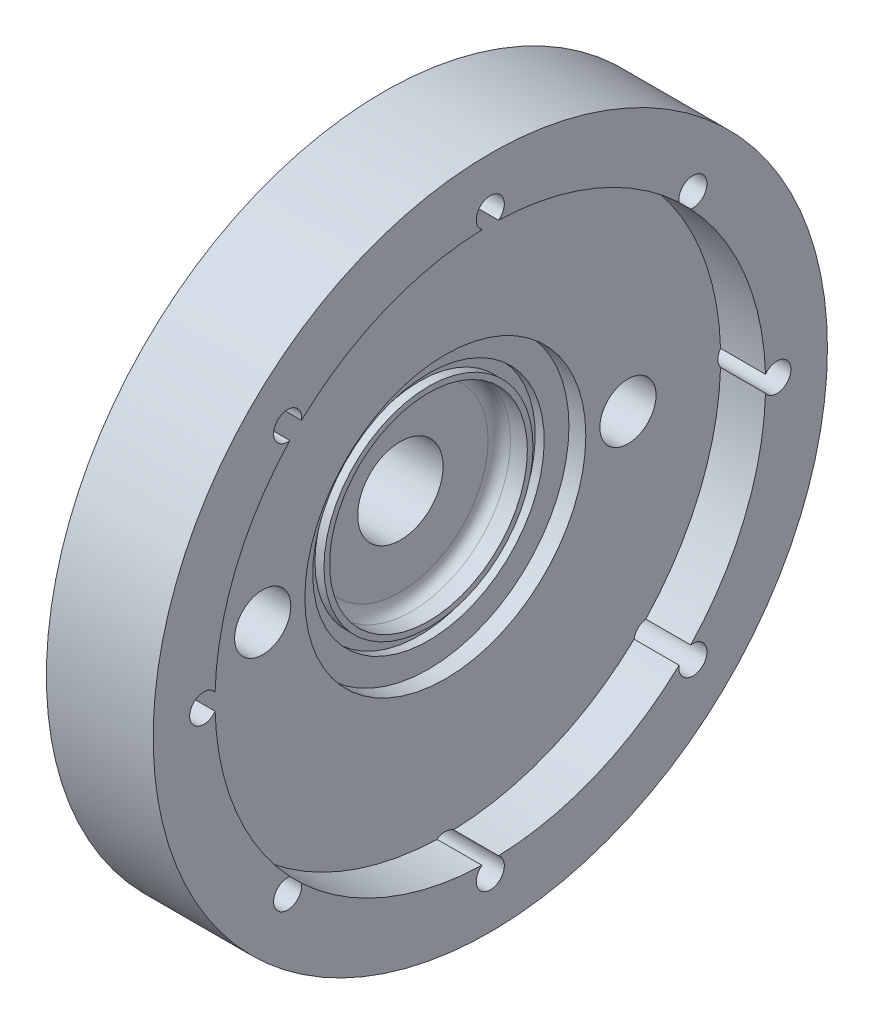
from build123d import *

# Parameters (mm, degrees)
SKETCH4_W               = 2.032
SKETCH4_H               = 2.54
SKETCH5_R               = 76.2
SKETCH5_R_2             = 31.75
BOSS_EXTRUDE1_DEPTH     = 3.81
SKETCH6_R               = 76.2
SKETCH6_R_2             = 62.23
BOSS_EXTRUDE2_DEPTH     = 10.16
CUT_EXTRUDE1_DEPTH      = 113.342968182
CUT_EXTRUDE1_DEPTH_BACK = 113.342968182
SKETCH2_R               = 6.35
SKETCH3_R               = 3.175
CUT_EXTRUDE2_DEPTH      = 113.342968182
CIRPATTERN1_COUNT       = 8


with BuildPart() as part:
    # Sketch1 → Revolve1 (revolve)
    with BuildSketch(Plane.XY, mode=Mode.PRIVATE) as revolve1_sk:
        with BuildLine():
            Line((0, 76.2), (-10.16, 76.2))
            Line((-10.16, 76.2), (-10.16, 21.082))
            ThreePointArc((-10.16, 21.082), (-11.647897552, 17.489897552), (-15.24, 16.002))
            Line((-15.24, 16.002), (-31.75, 16.002))
            Line((-31.75, 16.002), (-31.75, 9.652))
            Line((-31.75, 9.652), (-6.35, 9.652))
            Line((-6.35, 9.652), (-6.35, 19.812))
            ThreePointArc((-6.35, 19.812), (-5.606051224, 21.608051224), (-3.81, 22.352))
            Line((-3.81, 22.352), (0, 22.352))
            Line((0, 22.352), (0, 76.2))
        make_face()
    revolve(revolve1_sk.sketch.rotate(Axis((0, 0, 0), (-1, 0, 0)), 90), axis=Axis((0, 0, 0), (-1, 0, 0)))

    # Sketch4 → Cut-Revolve1 (revolve, cut)
    with BuildSketch(Plane.XY):
        with Locations((-1.016, 24.892)):
            Rectangle(SKETCH4_W, SKETCH4_H)
    revolve(axis=Axis((0, 0, 0), (-1, 0, 0)), mode=Mode.SUBTRACT)

    # Sketch5 → Boss-Extrude1 (add)
    with BuildSketch(Plane(origin=(0, 0, 0), x_dir=(0, 0, -1), z_dir=(1, 0, 0))):
        Circle(SKETCH5_R)
        with Locations(Location((0, 0, 0), (0, 0, 180))):
            Circle(SKETCH5_R_2, mode=Mode.SUBTRACT)
    extrude(amount=BOSS_EXTRUDE1_DEPTH)

    # Sketch6 → Boss-Extrude2 (add)
    with BuildSketch(Plane(origin=(3.81, 0, 0), x_dir=(0, 0, -1), z_dir=(1, 0, 0))):
        Circle(SKETCH6_R)
        Circle(SKETCH6_R_2, mode=Mode.SUBTRACT)
    extrude(amount=BOSS_EXTRUDE2_DEPTH)

    # Sketch2 → Cut-Extrude1 (cut, two sides: drawn at the far end of the back side and taken through both)
    with BuildSketch(Plane(origin=(0, 0, 0), x_dir=(0, 0, -1), z_dir=(1, 0, 0)).offset(-CUT_EXTRUDE1_DEPTH_BACK)):
        with Locations((41.275, 0)):
            Circle(SKETCH2_R)
        with Locations((-41.275, 0)):
            Circle(SKETCH2_R)
    extrude(amount=CUT_EXTRUDE1_DEPTH + CUT_EXTRUDE1_DEPTH_BACK, mode=Mode.SUBTRACT)

    # Sketch3 → Cut-Extrude2 (cut, symmetric)
    with BuildSketch(Plane(origin=(0, 0, 0), x_dir=(0, 0, -1), z_dir=(1, 0, 0))):
        with Locations(Location((64.77, 0, 0), (0, 0, 216.018854193))):
            Circle(SKETCH3_R)
    cut_extrude2 = extrude(amount=CUT_EXTRUDE2_DEPTH, both=True, mode=Mode.SUBTRACT)

    # CirPattern1: Cut-Extrude2 ×8 about axis
    cirpattern1_axis = Axis((0, 0, 0), (1, 0, 0))
    for i in range(1, CIRPATTERN1_COUNT):
        add(cut_extrude2.rotate(cirpattern1_axis, i * 360 / CIRPATTERN1_COUNT), mode=Mode.SUBTRACT)


solid = part.part
